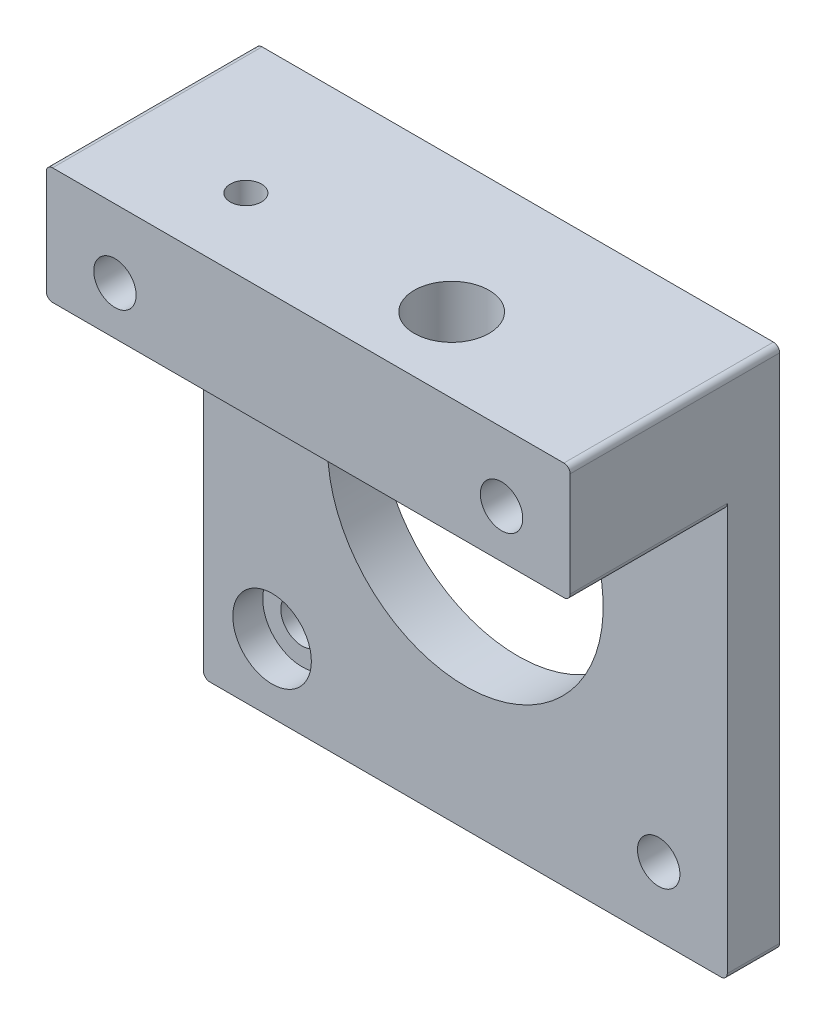
from build123d import *

# Parameters (mm, degrees)
SKETCH1_W            = 42
SKETCH1_H            = 42
BOSS_EXTRUDE1_DEPTH  = 16.8
SKETCH2_W            = 42
SKETCH2_H            = 32.65
CUT_EXTRUDE1_DEPTH   = 12.6
CUT_EXTRUDE2_REACH   = 36.121
SKETCH3_R            = 11.05
M3_CLEARANCE_HOLE1_D = 3.4
SKETCH6_R            = 3.15
CUT_EXTRUDE3_DEPTH   = 2.4
M3_TAPPED_HOLE1_D    = 2.5
FILLET1_R            = 0.5
SKETCH11_R           = 3
CUT_EXTRUDE4_DEPTH   = 10


with BuildPart() as part:
    # Sketch1 → Boss-Extrude1 (new body)
    with BuildSketch(Plane.XY):
        Rectangle(SKETCH1_W, SKETCH1_H)
    extrude(amount=BOSS_EXTRUDE1_DEPTH)

    # Sketch2 → Cut-Extrude1 (cut)
    with BuildSketch(Plane.XY.offset(16.8)):
        with Locations((0, -4.675)):
            Rectangle(SKETCH2_W, SKETCH2_H)
    extrude(amount=-CUT_EXTRUDE1_DEPTH, mode=Mode.SUBTRACT)

    # Sketch3 → Cut-Extrude2 (cut, up to next)
    with BuildSketch(Plane(origin=(0, 0, 0), x_dir=(-1, 0, 0), z_dir=(0, 0, -1)), mode=Mode.PRIVATE) as cut_extrude2_sk1:
        Circle(SKETCH3_R)
    cut_extrude2_tool1 = extrude(cut_extrude2_sk1.sketch, amount=-CUT_EXTRUDE2_REACH, mode=Mode.PRIVATE) & part.part
    add(cut_extrude2_tool1.solids().sort_by_distance((0, 0, 0))[0], mode=Mode.SUBTRACT)

    # M3 Clearance Hole1 (through all)
    with Locations(Plane.XY.offset(16.8)):
        with Locations((15.5, 15.5), (-15.5, 15.5), (-15.5, -15.5), (15.5, -15.5)):
            Hole(M3_CLEARANCE_HOLE1_D / 2)

    # Sketch6 → Cut-Extrude3 (cut)
    with BuildSketch(Plane.XY.offset(4.2)):
        with Locations((-15.5, -15.5)):
            Circle(SKETCH6_R)
    extrude(amount=-CUT_EXTRUDE3_DEPTH, mode=Mode.SUBTRACT)

    # M3 Tapped Hole1 (through all)
    with Locations(Plane(origin=(0, 21, 0), x_dir=(1, 0, 0), z_dir=(0, 1, 0))):
        with Locations((-11, -10.8)):
            Hole(M3_TAPPED_HOLE1_D / 2)

    # Fillet1
    fillet1_edges = [part.edges().sort_by_distance(p)[0] for p in [
        (21, -21, 2.1),
        (-21, -21, 2.1),
        (-21, 11.65, 10.5),
        (21, 11.65, 10.5),
        (-21, 21, 8.4),
        (21, 21, 8.4),
    ]]
    fillet(fillet1_edges, radius=FILLET1_R)

    # Sketch11 → Cut-Extrude4 (cut)
    with BuildSketch(Plane(origin=(0, 21, 0), x_dir=(1, 0, 0), z_dir=(0, 1, 0))):
        with Locations(Location((5.5, -10.8, 0), (0, 0, 270))):
            Circle(SKETCH11_R)
    extrude(amount=-CUT_EXTRUDE4_DEPTH, mode=Mode.SUBTRACT)


solid = part.part
